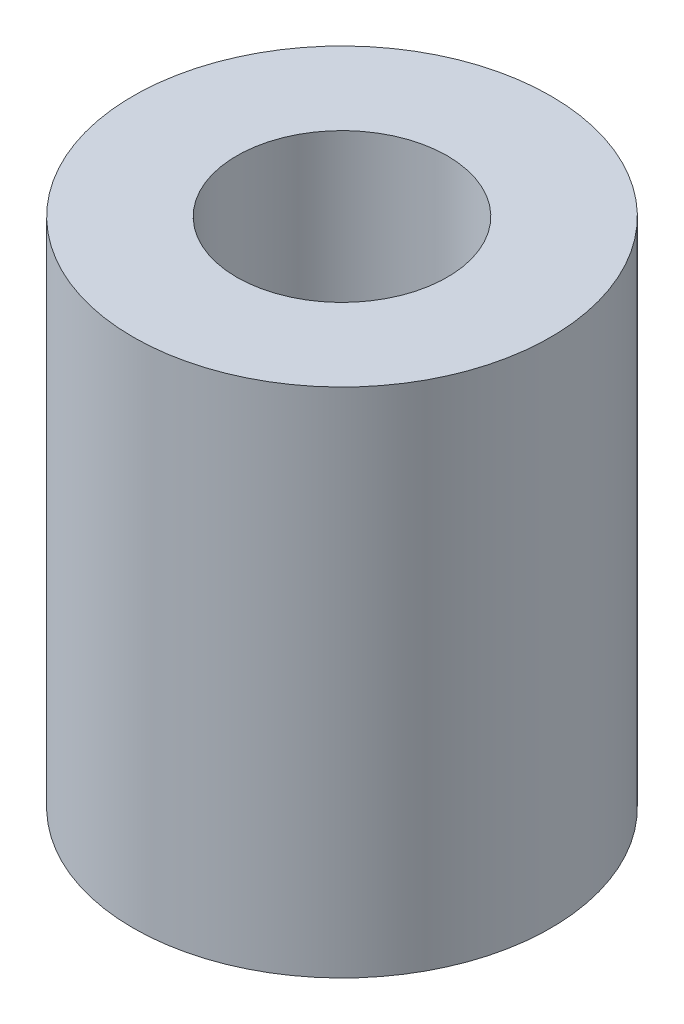
from build123d import *

# Parameters (mm, degrees)
SKETCH1_R           = 7.9375
BOSS_EXTRUDE1_DEPTH = 19.45
SKETCH3_R           = 4
CUT_EXTRUDE2_DEPTH  = 23.456854466


with BuildPart() as part:
    # Sketch1 → Boss-Extrude1 (new body)
    with BuildSketch(Plane(origin=(0, 0, 0), x_dir=(1, 0, 0), z_dir=(0, 1, 0))):
        with Locations(Location((0, 0, 0), (0, 0, 270))):
            Circle(SKETCH1_R)
    extrude(amount=BOSS_EXTRUDE1_DEPTH)

    # Sketch3 → Cut-Extrude2 (cut, through all)
    with BuildSketch(Plane(origin=(0, 19.45, 0), x_dir=(1, 0, 0), z_dir=(0, 1, 0))):
        with Locations(Location((0, 0, 0), (0, 0, 270))):
            Circle(SKETCH3_R)
    extrude(amount=-CUT_EXTRUDE2_DEPTH, mode=Mode.SUBTRACT)


solid = part.part
